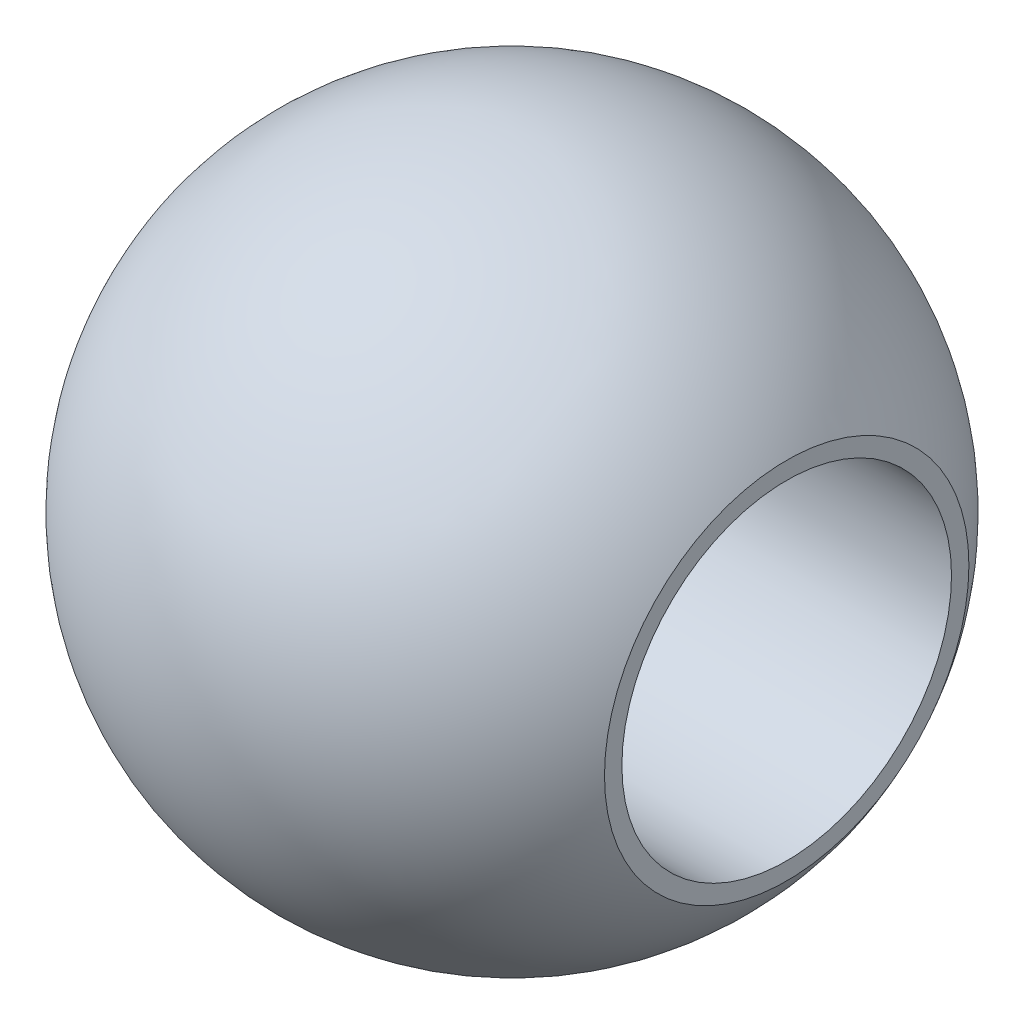
from build123d import *

# Parameters (mm, degrees)
CUT_EXTRUDE_1_DEPTH      = 10
CUT_EXTRUDE_1_DEPTH_BACK = 10
SKETCH_2_W               = 8.130865192
SKETCH_2_H               = 8.836363256
SKETCH_2_W_2             = 5
SKETCH_2_H_2             = 6.113384394
SKETCH_3_R               = 1.5
CUT_EXTRUDE_2_DEPTH      = 10


with BuildPart() as part:
    # 草图1 → 旋转1 (revolve)
    with BuildSketch(Plane(origin=(0, 0, 0), x_dir=(1, 0, 0), z_dir=(0, 1, 0))):
        with BuildLine():
            ThreePointArc((3, 0), (2.121320344, 2.121320344), (0, 3))
            Line((0, 3), (0, -3))
            ThreePointArc((0, -3), (2.121320344, -2.121320344), (3, 0))
        make_face()
    revolve(axis=Axis((0, 0, -3), (0, 0, 1)))

    # 草图2 → 切除-拉伸1 (cut, two sides: drawn at the far end of the back side and taken through both)
    with BuildSketch(Plane(origin=(0, 0, 0), x_dir=(1, 0, 0), z_dir=(0, 1, 0)).offset(-CUT_EXTRUDE_1_DEPTH_BACK)):
        with Locations((0.270511146, -0.599851934)):
            Rectangle(SKETCH_2_W, SKETCH_2_H)
        Rectangle(SKETCH_2_W_2, SKETCH_2_H_2, mode=Mode.SUBTRACT)
    extrude(amount=CUT_EXTRUDE_1_DEPTH + CUT_EXTRUDE_1_DEPTH_BACK, mode=Mode.SUBTRACT)

    # 草图3 → 切除-拉伸2 (cut)
    with BuildSketch(Plane(origin=(2.5, 0, 0), x_dir=(0, 0, -1), z_dir=(1, 0, 0))):
        Circle(SKETCH_3_R)
    extrude(amount=-CUT_EXTRUDE_2_DEPTH, mode=Mode.SUBTRACT)


solid = part.part
